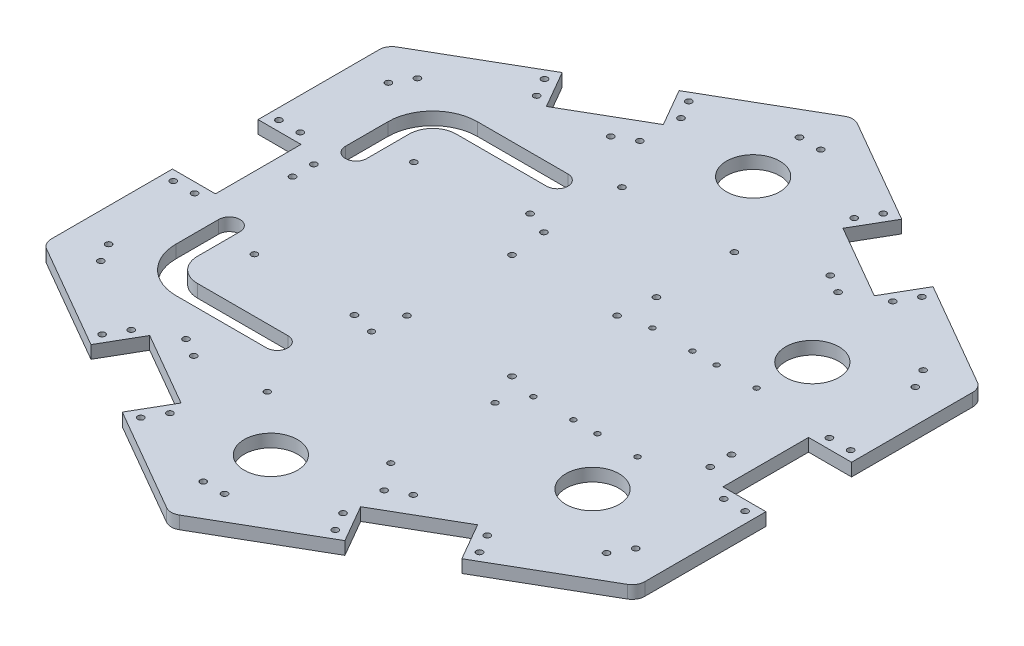
from build123d import *

# Parameters (mm, degrees)
SKETCH1_R           = 1.45
BOSS_EXTRUDE2_DEPTH = 3
SKETCH2_R           = 1.45
CUT_EXTRUDE1_DEPTH  = 161.808628333
CIRPATTERN7_COUNT   = 6
SKETCH3_R           = 1.45
CUT_EXTRUDE2_DEPTH  = 213.272030532
SKETCH4_R           = 1.25
CUT_EXTRUDE3_DEPTH  = 213.272030532
SKETCH5_R           = 1.45
CUT_EXTRUDE4_DEPTH  = 213.272030532
SKETCH6_R           = 1.375
CUT_EXTRUDE5_DEPTH  = 213.272030532
SKETCH7_R           = 1.45
CUT_EXTRUDE6_DEPTH  = 213.272030532
SKETCH9_R           = 12.5
CUT_EXTRUDE7_DEPTH  = 213.272030532
SKETCH10_R          = 12.5
CUT_EXTRUDE8_DEPTH  = 213.272030532


with BuildPart() as part:
    # Sketch1 → Boss-Extrude2 (new, symmetric)
    with BuildSketch(Plane(origin=(0, 0, 0), x_dir=(1, 0, 0), z_dir=(0, 1, 0))):
        with BuildLine():
            Line((-139.367912183, 20.1), (-119.167912183, 20.1))
            Line((-119.167912183, 20.1), (-119.167912183, -20.1))
            Line((-119.167912183, -20.1), (-139.367912183, -20.1))
            Line((-139.367912183, -20.1), (-139.367912183, -77))
            ThreePointArc((-139.367912183, -77), (-139.163467141, -78.552914271), (-138.564064606, -80))
            Line((-138.564064606, -80), (0, 0))
            Line((0, 0), (-138.564064606, 80))
            ThreePointArc((-138.564064606, 80), (-139.163467141, 78.552914271), (-139.367912183, 77))
            Line((-139.367912183, 77), (-139.367912183, 20.1))
        make_face()
        with Locations(Location((-123.74355653, 65.669872981, 0), (0, 0, 270))):
            Circle(SKETCH1_R, mode=Mode.SUBTRACT)
        with Locations(Location((-123.74355653, -65.669872981, 0), (0, 0, 90))):
            Circle(SKETCH1_R, mode=Mode.SUBTRACT)
    boss_extrude2 = extrude(amount=BOSS_EXTRUDE2_DEPTH, both=True)

    # Sketch2 → Cut-Extrude1 (cut, through all)
    with BuildSketch(Plane(origin=(0, 3, 0), x_dir=(1, 0, 0), z_dir=(0, 1, 0))):
        with Locations(Location((-134.267912183, 24.8, 0), (0, 0, 270))):
            Circle(SKETCH2_R)
        with Locations(Location((-124.267912183, 24.8, 0), (0, 0, 90))):
            Circle(SKETCH2_R)
        with Locations(Location((-124.267912183, -24.8, 0), (0, 0, 270))):
            Circle(SKETCH2_R)
        with Locations(Location((-134.267912183, -24.8, 0), (0, 0, 90))):
            Circle(SKETCH2_R)
        with Locations(Location((-108.067912183, 15, 0), (0, 0, 270))):
            Circle(SKETCH2_R)
        with Locations(Location((-108.067912183, 5, 0), (0, 0, 270))):
            Circle(SKETCH2_R)
    cut_extrude1 = extrude(amount=-CUT_EXTRUDE1_DEPTH, mode=Mode.SUBTRACT)

    # CirPattern7: Boss-Extrude2, Cut-Extrude1 ×6 about axis
    cirpattern7_axis = Axis((0, 0, 0), (0, 1, 0))
    add([boss_extrude2.rotate(cirpattern7_axis, i * 360 / CIRPATTERN7_COUNT) for i in range(1, CIRPATTERN7_COUNT)])
    add([cut_extrude1.rotate(cirpattern7_axis, i * 360 / CIRPATTERN7_COUNT) for i in range(1, CIRPATTERN7_COUNT)], mode=Mode.SUBTRACT)

    # Sketch3 → Cut-Extrude2 (cut, through all)
    with BuildSketch(Plane(origin=(0, 3, 0), x_dir=(1, 0, 0), z_dir=(0, 1, 0))):
        with Locations(Location((-24.675, 24.675, 0), (0, 0, 270))):
            Circle(SKETCH3_R)
        with Locations(Location((24.675, 24.675, 0), (0, 0, 90))):
            Circle(SKETCH3_R)
        with Locations(Location((24.675, -24.675, 0), (0, 0, 270))):
            Circle(SKETCH3_R)
        with Locations(Location((-24.675, -24.675, 0), (0, 0, 90))):
            Circle(SKETCH3_R)
    extrude(amount=-CUT_EXTRUDE2_DEPTH, mode=Mode.SUBTRACT)

    # Sketch4 → Cut-Extrude3 (cut, through all)
    with BuildSketch(Plane(origin=(0, 3, 0), x_dir=(1, 0, 0), z_dir=(0, 1, 0))):
        with Locations(Location((38, 27.95, 0), (0, 0, 270))):
            Circle(SKETCH4_R)
        with Locations(Location((56.8, 27.95, 0), (0, 0, 270))):
            Circle(SKETCH4_R)
        with Locations(Location((68.1, 27.95, 0), (0, 0, 270))):
            Circle(SKETCH4_R)
        with Locations(Location((86.9, 27.95, 0), (0, 0, 270))):
            Circle(SKETCH4_R)
        with Locations(Location((86.9, -27.95, 0), (0, 0, 90))):
            Circle(SKETCH4_R)
        with Locations(Location((68.1, -27.95, 0), (0, 0, 90))):
            Circle(SKETCH4_R)
        with Locations(Location((56.8, -27.95, 0), (0, 0, 90))):
            Circle(SKETCH4_R)
        with Locations(Location((38, -27.95, 0), (0, 0, 90))):
            Circle(SKETCH4_R)
    extrude(amount=-CUT_EXTRUDE3_DEPTH, mode=Mode.SUBTRACT)

    # Sketch5 → Cut-Extrude4 (cut, through all)
    with BuildSketch(Plane(origin=(0, 3, 0), x_dir=(1, 0, 0), z_dir=(0, 1, 0))):
        with Locations(Location((-85.46, -35.53, 0), (0, 0, 270))):
            Circle(SKETCH5_R)
        with Locations(Location((-85.46, 39.35, 0), (0, 0, 270))):
            Circle(SKETCH5_R)
        with Locations(Location((-37.24, 45.71, 0), (0, 0, 270))):
            Circle(SKETCH5_R)
        with Locations(Location((-37.24, -36.76, 0), (0, 0, 270))):
            Circle(SKETCH5_R)
    extrude(amount=-CUT_EXTRUDE4_DEPTH, mode=Mode.SUBTRACT)

    # Sketch6 → Cut-Extrude5 (cut, through all)
    with BuildSketch(Plane(origin=(0, 3, 0), x_dir=(1, 0, 0), z_dir=(0, 1, 0))):
        with Locations(Location((-26.5, -39.45, 0), (0, 0, 270))):
            Circle(SKETCH6_R)
        with Locations(Location((31.5, -39.45, 0), (0, 0, 270))):
            Circle(SKETCH6_R)
        with Locations(Location((31.5, -88.45, 0), (0, 0, 270))):
            Circle(SKETCH6_R)
        with Locations(Location((-26.5, -88.45, 0), (0, 0, 270))):
            Circle(SKETCH6_R)
    extrude(amount=-CUT_EXTRUDE5_DEPTH, mode=Mode.SUBTRACT)

    # Sketch7 → Cut-Extrude6 (cut, through all)
    with BuildSketch(Plane(origin=(0, 3, 0), x_dir=(1, 0, 0), z_dir=(0, 1, 0))):
        with Locations(Location((-26.415, 78.025, 0), (0, 0, 270))):
            Circle(SKETCH7_R)
        with Locations(Location((26.415, 78.025, 0), (0, 0, 270))):
            Circle(SKETCH7_R)
        with Locations(Location((26.415, 41.395, 0), (0, 0, 270))):
            Circle(SKETCH7_R)
        with Locations(Location((-26.415, 41.395, 0), (0, 0, 270))):
            Circle(SKETCH7_R)
    extrude(amount=-CUT_EXTRUDE6_DEPTH, mode=Mode.SUBTRACT)

    # Sketch9 → Cut-Extrude7 (cut, through all)
    with BuildSketch(Plane(origin=(0, 3, 0), x_dir=(1, 0, 0), z_dir=(0, 1, 0))):
        with Locations(Location((89.419235407, -51.626219633, 0), (0, 0, 270))):
            Circle(SKETCH9_R)
        with Locations(Location((89.419235407, 51.626219633, 0), (0, 0, 90))):
            Circle(SKETCH9_R)
        with BuildLine():
            Line((-108, -29.76), (-108, -49.76))
            ThreePointArc((-108, -49.76), (-101.849242405, -64.609242405), (-87, -70.76))
            Line((-87, -70.76), (-44.5, -70.76))
            ThreePointArc((-44.5, -70.76), (-39.5, -65.76), (-44.5, -60.76))
            Line((-44.5, -60.76), (-87, -60.76))
            ThreePointArc((-87, -60.76), (-94.778174593, -57.538174593), (-98, -49.76))
            Line((-98, -49.76), (-98, -29.76))
            ThreePointArc((-98, -29.76), (-103, -24.76), (-108, -29.76))
        make_face()
        with BuildLine():
            Line((-98, 49.76), (-98, 29.76))
            ThreePointArc((-98, 29.76), (-103, 24.76), (-108, 29.76))
            Line((-108, 29.76), (-108, 49.76))
            ThreePointArc((-108, 49.76), (-101.849242405, 64.609242405), (-87, 70.76))
            Line((-87, 70.76), (-44.5, 70.76))
            ThreePointArc((-44.5, 70.76), (-39.5, 65.76), (-44.5, 60.76))
            Line((-44.5, 60.76), (-87, 60.76))
            ThreePointArc((-87, 60.76), (-94.778174593, 57.538174593), (-98, 49.76))
        make_face()
    extrude(amount=-CUT_EXTRUDE7_DEPTH, mode=Mode.SUBTRACT)

    # Sketch10 → Cut-Extrude8 (cut, through all)
    with BuildSketch(Plane(origin=(0, 3, 0), x_dir=(1, 0, 0), z_dir=(0, 1, 0))):
        with Locations(Location((0, -113.252439266, 0), (0, 0, 270))):
            Circle(SKETCH10_R)
        with Locations(Location((0, 113.252439266, 0), (0, 0, 90))):
            Circle(SKETCH10_R)
    extrude(amount=-CUT_EXTRUDE8_DEPTH, mode=Mode.SUBTRACT)


solid = part.part
